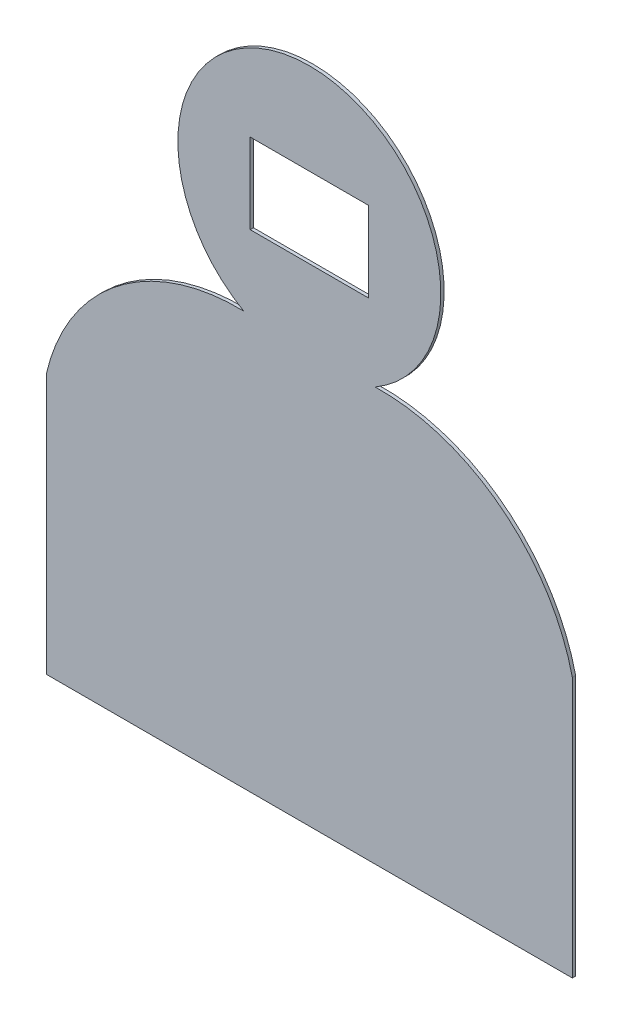
from build123d import *

# Parameters (mm, degrees)
SKETCH1_W           = 180
SKETCH1_H           = 122
BOSS_EXTRUDE1_DEPTH = 5


with BuildPart() as part:
    # Sketch1 → Boss-Extrude1 (new body)
    with BuildSketch(Plane.XY):
        with BuildLine():
            Line((-447.591580819, 337.042460879), (-447.591580819, -59.082484796))
            Line((-447.591580819, -59.082484796), (352.408419181, -59.082484796))
            Line((352.408419181, -59.082484796), (352.408419181, 337.042460879))
            ThreePointArc((352.408419181, 337.042460879), (243.83842934, 506.739072759), (52.408419181, 569.5))
            ThreePointArc((52.408419181, 569.5), (-47.591580819, 942.705080757), (-147.591580819, 569.5))
            ThreePointArc((-147.591580819, 569.5), (-339.021590977, 506.739072759), (-447.591580819, 337.042460879))
        make_face()
        with Locations((-47.591580819, 742.705080757)):
            Rectangle(SKETCH1_W, SKETCH1_H, mode=Mode.SUBTRACT)
    extrude(amount=BOSS_EXTRUDE1_DEPTH)


solid = part.part
